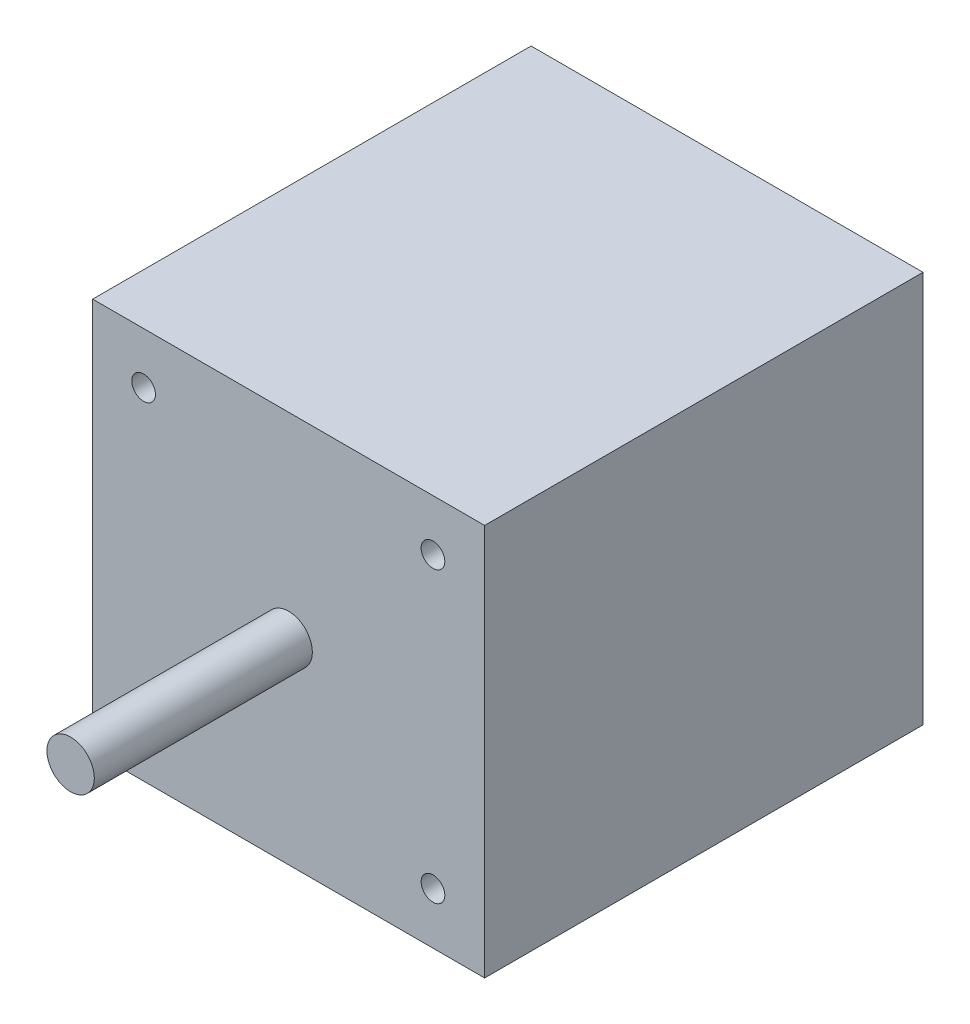
from build123d import *

# Parameters (mm, degrees)
SKETCH1_W           = 42.0116
SKETCH1_H           = 42.01
BOSS_EXTRUDE1_DEPTH = 23.495
SKETCH2_R           = 2.54
BOSS_EXTRUDE2_DEPTH = 23.368
SKETCH3_R           = 1.27
CUT_EXTRUDE1_DEPTH  = 5.588


with BuildPart() as part:
    # Sketch1 → Boss-Extrude1 (new, symmetric)
    with BuildSketch(Plane.XY):
        Rectangle(SKETCH1_W, SKETCH1_H)
    extrude(amount=BOSS_EXTRUDE1_DEPTH, both=True)

    # Sketch2 → Boss-Extrude2 (add)
    with BuildSketch(Plane.XY.offset(23.495)):
        Circle(SKETCH2_R)
    extrude(amount=BOSS_EXTRUDE2_DEPTH)

    # Sketch3 → Cut-Extrude1 (cut)
    with BuildSketch(Plane.XY.offset(23.495)):
        with Locations((15.4686, -15.4678)):
            Circle(SKETCH3_R)
        with Locations((-15.5448, 15.5186)):
            Circle(SKETCH3_R)
        with Locations((15.4686, 15.5186)):
            Circle(SKETCH3_R)
        with Locations((-15.5448, -15.4678)):
            Circle(SKETCH3_R)
    extrude(amount=-CUT_EXTRUDE1_DEPTH, mode=Mode.SUBTRACT)


solid = part.part
